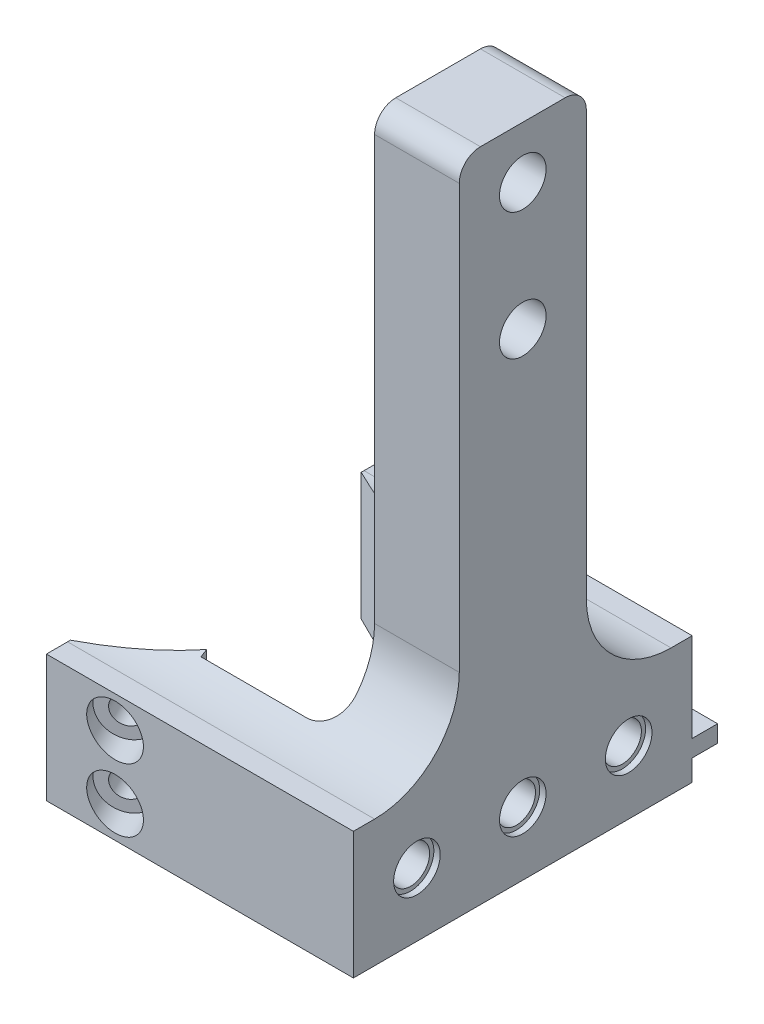
from build123d import *

# Parameters (mm, degrees)
BOSS_EXTRUDE1_DEPTH            = 7.5
CBORE_FOR_M3_SHCS1_AT_2_COUNT  = 2
CBORE_FOR_M3_SHCS1_AT_2_PITCH  = 7.5
FILLET1_R                      = 3
CBORE_FOR_M3_SHCS2_D           = 4.5
CBORE_FOR_M3_SHCS2_DEPTH       = 7
CBORE_FOR_M3_SHCS2_CBORE_D     = 5.5
CBORE_FOR_M3_SHCS2_CBORE_DEPTH = 0.75
CBORE_FOR_M3_SHCS2_TIP         = 1.351936393
SKETCH9_W                      = 15
SKETCH9_H                      = 62.5
BOSS_EXTRUDE2_DEPTH            = 10
CBORE_FOR_M5_SHCS1_D           = 5.5
CBORE_FOR_M5_SHCS1_DEPTH       = 15
CBORE_FOR_M5_SHCS1_CBORE_D     = 9
CBORE_FOR_M5_SHCS1_CBORE_DEPTH = 5
CBORE_FOR_M5_SHCS1_TIP         = 1.652366702
SKETCH12_W                     = 22.5
SKETCH12_H                     = 2
BOSS_EXTRUDE3_DEPTH            = 3
FILLET2_R                      = 10
FILLET3_R                      = 2.5


with BuildPart() as part:
    # Sketch1 → Boss-Extrude1 (new, symmetric)
    with BuildSketch(Plane(origin=(0, 0, 0), x_dir=(1, 0, 0), z_dir=(0, 1, 0))):
        Polygon((0, 12.5), (0, -12.5), (-15.5, -12.5), (-15.5, -11.829), (-26.247516559, -17.166685624), (-26.247516559, -20), (10, -20), (10, 20), (-26.247516559, 20), (-26.247516559, 17.166685624), (-15.5, 11.829), (-15.5, 12.5), align=None)
    extrude(amount=BOSS_EXTRUDE1_DEPTH, both=True)

    # Sketch4 → CBORE for M3 SHCS1 (revolve, cut)
    with BuildSketch(Plane(origin=(-20.873758279, 3.75, -14.497842812), x_dir=(0.8956263799062305, 0, 0.4448071353025496), z_dir=(0, 1, 0))):
        Polygon((0, 0), (0, 18.6607451), (3, 18.6607451), (3, 3), (1.625, 3), (1.625, 0), align=None)
    cbore_for_m3_shcs1 = revolve(axis=Axis((-23.698283589, 3.75, -8.810615299), (0.44480713530254956, 0, -0.8956263799062304)), mode=Mode.SUBTRACT)

    # CBORE for M3 SHCS1 at 2: CBORE for M3 SHCS1 ×2
    with Locations(*[(0, -i * CBORE_FOR_M3_SHCS1_AT_2_PITCH, 0) for i in range(1, CBORE_FOR_M3_SHCS1_AT_2_COUNT)]):
        add(cbore_for_m3_shcs1, mode=Mode.SUBTRACT)

    # Mirror1: CBORE for M3 SHCS1 across plane
    add(cbore_for_m3_shcs1.mirror(Plane.XY), mode=Mode.SUBTRACT)

    # Mirror1 copy 1 sketch → Mirror1 copy 1 (revolve, cut)
    with BuildSketch(Plane(origin=(-20.873758279, -3.75, 14.497842812), x_dir=(0.8956263799062305, 0, -0.4448071353025496), z_dir=(0, 1, 0))):
        Polygon((0, 0), (0, -18.6607451), (3, -18.6607451), (3, -3), (1.625, -3), (1.625, 0), align=None)
    revolve(axis=Axis((-23.698283589, -3.75, 8.810615299), (-0.44480713530254956, 0, -0.8956263799062304)), mode=Mode.SUBTRACT)

    # Fillet1
    fillet1_edges = [part.edges().sort_by_distance(p)[0] for p in [
        (0, 0, 12.5),
        (0, 0, -12.5),
    ]]
    fillet(fillet1_edges, radius=FILLET1_R)

    # CBORE for M3 SHCS2
    with Locations(Plane(origin=(10, 0, 0), x_dir=(0, 0, -1), z_dir=(1, 0, 0))):
        with Locations((-12.5, 0), (0, 0), (12.5, 0)):
            CounterBoreHole(CBORE_FOR_M3_SHCS2_D / 2, CBORE_FOR_M3_SHCS2_CBORE_D / 2, CBORE_FOR_M3_SHCS2_CBORE_DEPTH, depth=CBORE_FOR_M3_SHCS2_DEPTH)
            with Locations((0, 0, -(CBORE_FOR_M3_SHCS2_DEPTH + CBORE_FOR_M3_SHCS2_TIP / 2))):  # 118° drill point
                Cone(0, CBORE_FOR_M3_SHCS2_D / 2, CBORE_FOR_M3_SHCS2_TIP, mode=Mode.SUBTRACT)

    # Sketch9 → Boss-Extrude2 (add)
    with BuildSketch(Plane(origin=(10, 0, 0), x_dir=(0, 0, -1), z_dir=(1, 0, 0))):
        with Locations((0, 38.75)):
            Rectangle(SKETCH9_W, SKETCH9_H)
    extrude(amount=-BOSS_EXTRUDE2_DEPTH)

    # CBORE for M5 SHCS1
    with Locations(Plane(origin=(0, 0, 0), x_dir=(0, 0, -1), z_dir=(-1, 0, 0))):
        with Locations((0, -63.85), (0, -48.85)):
            CounterBoreHole(CBORE_FOR_M5_SHCS1_D / 2, CBORE_FOR_M5_SHCS1_CBORE_D / 2, CBORE_FOR_M5_SHCS1_CBORE_DEPTH, depth=CBORE_FOR_M5_SHCS1_DEPTH)
            with Locations((0, 0, -(CBORE_FOR_M5_SHCS1_DEPTH + CBORE_FOR_M5_SHCS1_TIP / 2))):  # 118° drill point
                Cone(0, CBORE_FOR_M5_SHCS1_D / 2, CBORE_FOR_M5_SHCS1_TIP, mode=Mode.SUBTRACT)

    # Sketch12 → Boss-Extrude3 (add)
    with BuildSketch(Plane(origin=(0, 0, -20), x_dir=(-1, 0, 0), z_dir=(0, 0, -1))):
        with Locations((1.25, -4)):
            Rectangle(SKETCH12_W, SKETCH12_H)
    extrude(amount=BOSS_EXTRUDE3_DEPTH)

    # Fillet2
    fillet2_edges = [part.edges().sort_by_distance(p)[0] for p in [
        (5, 7.5, -7.5),
        (5, 7.5, 7.5),
    ]]
    fillet(fillet2_edges, radius=FILLET2_R)

    # Fillet3
    fillet3_edges = [part.edges().sort_by_distance(p)[0] for p in [
        (5, 70, -7.5),
        (5, 70, 7.5),
    ]]
    fillet(fillet3_edges, radius=FILLET3_R)


solid = part.part
